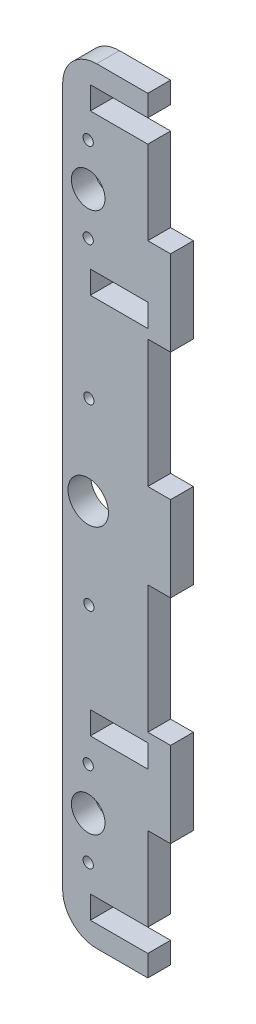
from build123d import *

# Parameters (mm, degrees)
MODEL_R             = 4.75
MODEL_R_2           = 3.95
MODEL_R_3           = 1.2
MODEL_W             = 13.50000035
MODEL_H             = 5.350001156
MODEL_H_2           = 5.350008607
BOSS_EXTRUDE1_DEPTH = 5.35


with BuildPart() as part:
    # Model → Boss-Extrude1 (new body)
    with BuildSketch(Plane.XY):
        with BuildLine():
            Line((19.999999553, 174.99999702), (19.999999553, 180.000007153))
            Line((19.999999553, 180.000007153), (7.999999449, 180.000007153))
            ThreePointArc((7.999999449, 180.000007153), (2.343145556, 177.656861207), (0, 172.000007153))
            Line((0, 172.000007153), (0, 8.00000038))
            ThreePointArc((0, 8.00000038), (2.343145616, 2.343145885), (8, 0))
            Line((8, 0), (19.999999553, 0))
            Line((19.999999553, 0), (19.999999553, 4.999999888))
            Line((19.999999553, 4.999999888), (6.499999203, 4.999999888))
            Line((6.499999203, 4.999999888), (6.499999203, 10.350000113))
            Line((6.499999203, 10.350000113), (19.999999553, 10.350000113))
            Line((19.999999553, 10.350000113), (19.999999553, 29.99999933))
            Line((19.999999553, 29.99999933), (25.349999778, 29.99999933))
            Line((25.349999778, 29.99999933), (25.349999778, 50.000000745))
            Line((25.349999778, 50.000000745), (19.999999553, 50.000000745))
            Line((19.999999553, 50.000000745), (19.999999553, 79.999998212))
            Line((19.999999553, 79.999998212), (25.349999778, 79.999998212))
            Line((25.349999778, 79.999998212), (25.349999778, 100.00000149))
            Line((25.349999778, 100.00000149), (19.999999553, 100.00000149))
            Line((19.999999553, 100.00000149), (19.999999553, 129.999995232))
            Line((19.999999553, 129.999995232), (25.349999778, 129.999995232))
            Line((25.349999778, 129.999995232), (25.349999778, 150.000005961))
            Line((25.349999778, 150.000005961), (19.999999553, 150.000005961))
            Line((19.999999553, 150.000005961), (19.999999553, 169.650003314))
            Line((19.999999553, 169.650003314), (6.499999203, 169.650003314))
            Line((6.499999203, 169.650003314), (6.499999203, 174.99999702))
            Line((6.499999203, 174.99999702), (19.999999553, 174.99999702))
        make_face()
        with Locations((5.999999553, 90)):
            Circle(MODEL_R, mode=Mode.SUBTRACT)
        with Locations((5.999999553, 26.5)):
            Circle(MODEL_R_2, mode=Mode.SUBTRACT)
        with Locations((5.999999553, 153.5)):
            Circle(MODEL_R_2, mode=Mode.SUBTRACT)
        with Locations((6.159999553, 111)):
            Circle(MODEL_R_3, mode=Mode.SUBTRACT)
        with Locations((6.159999553, 69)):
            Circle(MODEL_R_3, mode=Mode.SUBTRACT)
        with Locations((5.999999553, 36.5)):
            Circle(MODEL_R_3, mode=Mode.SUBTRACT)
        with Locations((5.999999553, 16.5)):
            Circle(MODEL_R_3, mode=Mode.SUBTRACT)
        with Locations((5.999999553, 143.5)):
            Circle(MODEL_R_3, mode=Mode.SUBTRACT)
        with Locations((5.999999553, 163.5)):
            Circle(MODEL_R_3, mode=Mode.SUBTRACT)
        with Locations((13.249999378, 45.175001025)):
            Rectangle(MODEL_W, MODEL_H, mode=Mode.SUBTRACT)
        with Locations((13.249999378, 134.824998677)):
            Rectangle(MODEL_W, MODEL_H_2, mode=Mode.SUBTRACT)
    extrude(amount=BOSS_EXTRUDE1_DEPTH)


solid = part.part
